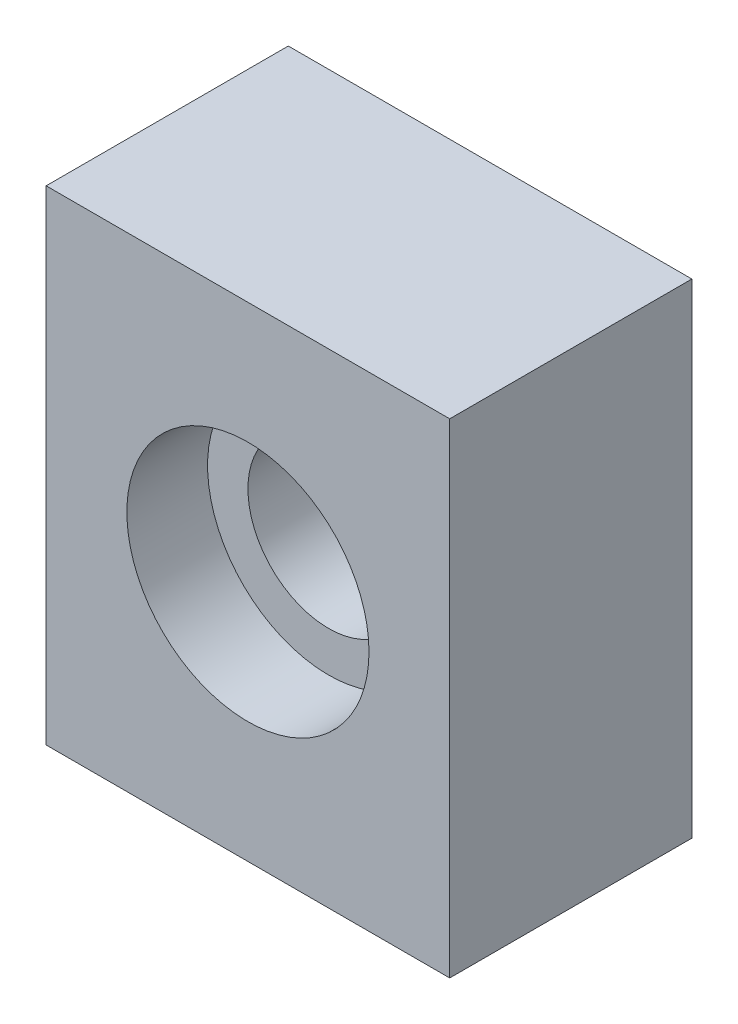
from build123d import *

# Parameters (mm, degrees)
ESQUISSE1_W             = 50
ESQUISSE1_H             = 60
ESQUISSE1_R             = 10
BOSS_EXTRU_1_DEPTH      = 30
ESQUISSE2_R             = 15
ENL_V_MAT_EXTRU_1_DEPTH = 10


with BuildPart() as part:
    # Esquisse1 → Boss.-Extru.1 (new body)
    with BuildSketch(Plane.XY):
        Rectangle(ESQUISSE1_W, ESQUISSE1_H)
        Circle(ESQUISSE1_R, mode=Mode.SUBTRACT)
    extrude(amount=BOSS_EXTRU_1_DEPTH)

    # Esquisse2 → Enlèv. mat.-Extru.1 (cut)
    with BuildSketch(Plane.XY.offset(30)):
        Circle(ESQUISSE2_R)
    extrude(amount=-ENL_V_MAT_EXTRU_1_DEPTH, mode=Mode.SUBTRACT)


solid = part.part
